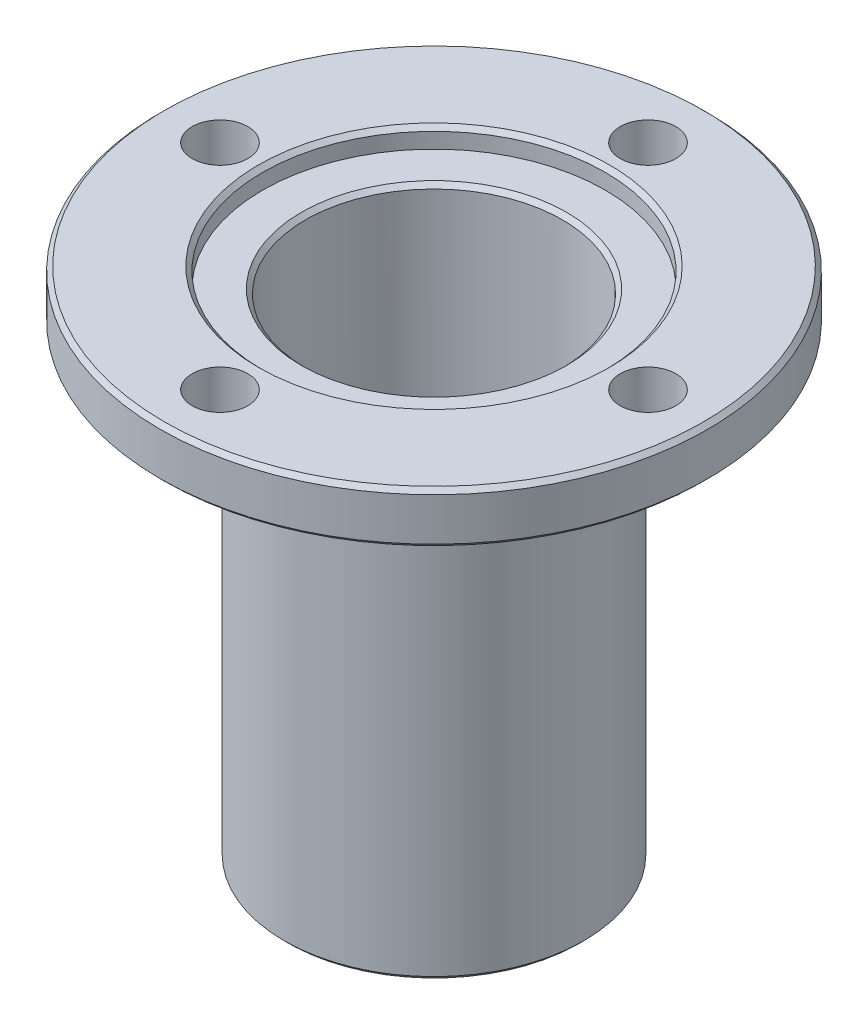
from build123d import *

# Parameters (mm, degrees)
SKETCH1_R           = 32
BOSS_EXTRUDE1_DEPTH = 6
SKETCH2_R           = 17.5
BOSS_EXTRUDE2_DEPTH = 54
SKETCH3_R           = 20
CUT_EXTRUDE1_DEPTH  = 2.3
SKETCH4_R           = 15
CUT_EXTRUDE2_DEPTH  = 74.3300075
SKETCH5_R           = 3.25
CUT_EXTRUDE3_DEPTH  = 76.153176912
CHAMFER1_SIZE       = 0.5


with BuildPart() as part:
    # Sketch1 → Boss-Extrude1 (new body)
    with BuildSketch(Plane(origin=(0, 0, 0), x_dir=(1, 0, 0), z_dir=(0, 1, 0))):
        with Locations(Location((0, 0, 0), (0, 0, 270))):
            Circle(SKETCH1_R)
    extrude(amount=BOSS_EXTRUDE1_DEPTH)

    # Sketch2 → Boss-Extrude2 (add)
    with BuildSketch(Plane.XZ):
        with Locations(Location((0, 0, 0), (0, 0, 270))):
            Circle(SKETCH2_R)
    extrude(amount=BOSS_EXTRUDE2_DEPTH)

    # Sketch3 → Cut-Extrude1 (cut)
    with BuildSketch(Plane(origin=(0, 6, 0), x_dir=(1, 0, 0), z_dir=(0, 1, 0))):
        with Locations(Location((0, 0, 0), (0, 0, 270))):
            Circle(SKETCH3_R)
    extrude(amount=-CUT_EXTRUDE1_DEPTH, mode=Mode.SUBTRACT)

    # Sketch4 → Cut-Extrude2 (cut, through all)
    with BuildSketch(Plane(origin=(0, 3.7, 0), x_dir=(1, 0, 0), z_dir=(0, 1, 0))):
        with Locations(Location((0, 0, 0), (0, 0, 270))):
            Circle(SKETCH4_R)
    extrude(amount=-CUT_EXTRUDE2_DEPTH, mode=Mode.SUBTRACT)

    # Sketch5 → Cut-Extrude3 (cut, through all)
    with BuildSketch(Plane(origin=(0, 6, 0), x_dir=(1, 0, 0), z_dir=(0, 1, 0))):
        with Locations(Location((0, 25, 0), (0, 0, 270))):
            Circle(SKETCH5_R)
        with Locations(Location((25, 0, 0), (0, 0, 270))):
            Circle(SKETCH5_R)
        with Locations(Location((0, -25, 0), (0, 0, 270))):
            Circle(SKETCH5_R)
        with Locations(Location((-25, 0, 0), (0, 0, 270))):
            Circle(SKETCH5_R)
    extrude(amount=-CUT_EXTRUDE3_DEPTH, mode=Mode.SUBTRACT)

    # Chamfer1
    chamfer1_edges = [part.edges().sort_by_distance(p)[0] for p in [
        (0, 6, -20),
        (0, -54, -15),
        (0, 3.7, -15),
        (0, 0, -32),
        (0, 6, -32),
        (0, -54, 17.5),
    ]]
    chamfer(chamfer1_edges, length=CHAMFER1_SIZE)


solid = part.part
